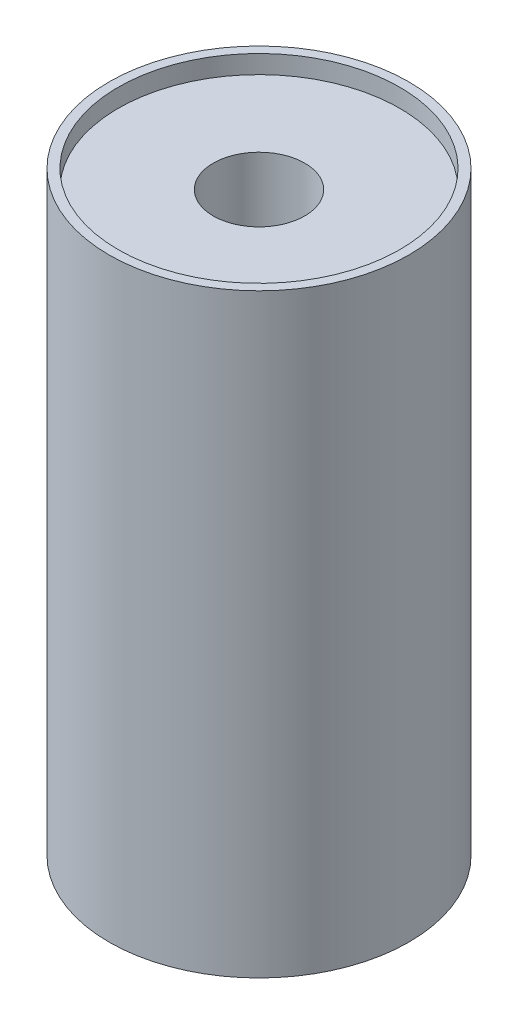
from build123d import *

# Parameters (mm, degrees)
SKETCH1_R               = 41.5925
BOSS_EXTRUDE1_DEPTH     = 165.1
CUT_EXTRUDE1_DEPTH      = 176.265176554
CUT_EXTRUDE1_DEPTH_BACK = 176.265176554
SKETCH2_R               = 12.7
SKETCH3_R               = 39.0525
CUT_EXTRUDE2_DEPTH      = 5.08
CUT_EXTRUDE3_START      = -2.54
SKETCH4_R               = 39.0525
SKETCH4_R_2             = 12.7
CUT_EXTRUDE3_DEPTH      = 2.54


with BuildPart() as part:
    # Sketch1 → Boss-Extrude1 (new body)
    with BuildSketch(Plane(origin=(0, 0, 0), x_dir=(1, 0, 0), z_dir=(0, 1, 0))):
        with Locations(Location((0, 0, 0), (0, 0, 270))):
            Circle(SKETCH1_R)
    extrude(amount=BOSS_EXTRUDE1_DEPTH)

    # Sketch2 → Cut-Extrude1 (cut, two sides: drawn at the far end of the back side and taken through both)
    with BuildSketch(Plane(origin=(0, 165.1, 0), x_dir=(1, 0, 0), z_dir=(0, 1, 0)).offset(-CUT_EXTRUDE1_DEPTH_BACK)):
        with Locations(Location((0, 0, 0), (0, 0, 270))):
            Circle(SKETCH2_R)
    extrude(amount=CUT_EXTRUDE1_DEPTH + CUT_EXTRUDE1_DEPTH_BACK, mode=Mode.SUBTRACT)

    # Sketch3 → Cut-Extrude2 (cut)
    with BuildSketch(Plane(origin=(0, 165.1, 0), x_dir=(1, 0, 0), z_dir=(0, 1, 0))):
        with Locations(Location((0, 0, 0), (0, 0, 270))):
            Circle(SKETCH3_R)
    extrude(amount=-CUT_EXTRUDE2_DEPTH, mode=Mode.SUBTRACT)

    # Sketch4 → Cut-Extrude3 (cut)
    with BuildSketch(Plane.XZ.offset(CUT_EXTRUDE3_START)):
        with Locations(Location((0, 0, 0), (0, 0, 90))):
            Circle(SKETCH4_R)
        with Locations(Location((0, 0, 0), (0, 0, 90))):
            Circle(SKETCH4_R_2, mode=Mode.SUBTRACT)
    extrude(amount=CUT_EXTRUDE3_DEPTH, mode=Mode.SUBTRACT)


solid = part.part
